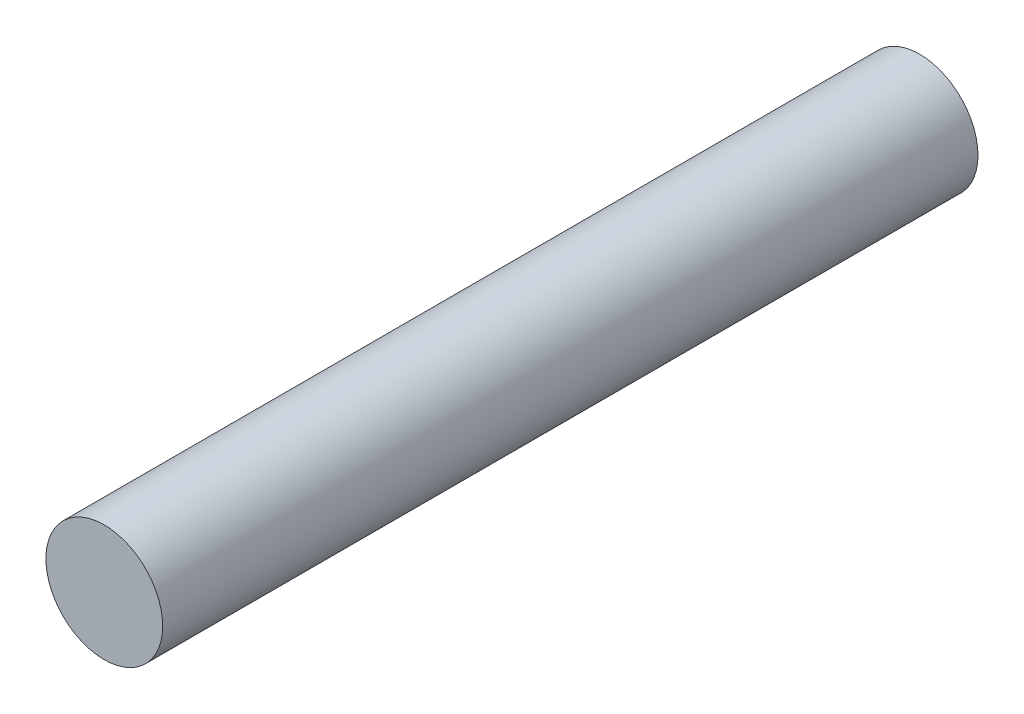
from build123d import *

# Parameters (mm, degrees)
SKETCH1_R           = 45.82477688
BOSS_EXTRUDE1_DEPTH = 640


with BuildPart() as part:
    # Sketch1 → Boss-Extrude1 (new body)
    with BuildSketch(Plane.XY):
        with Locations((-312.49550813, -65.466936061)):
            Circle(SKETCH1_R)
    extrude(amount=BOSS_EXTRUDE1_DEPTH)


solid = part.part
